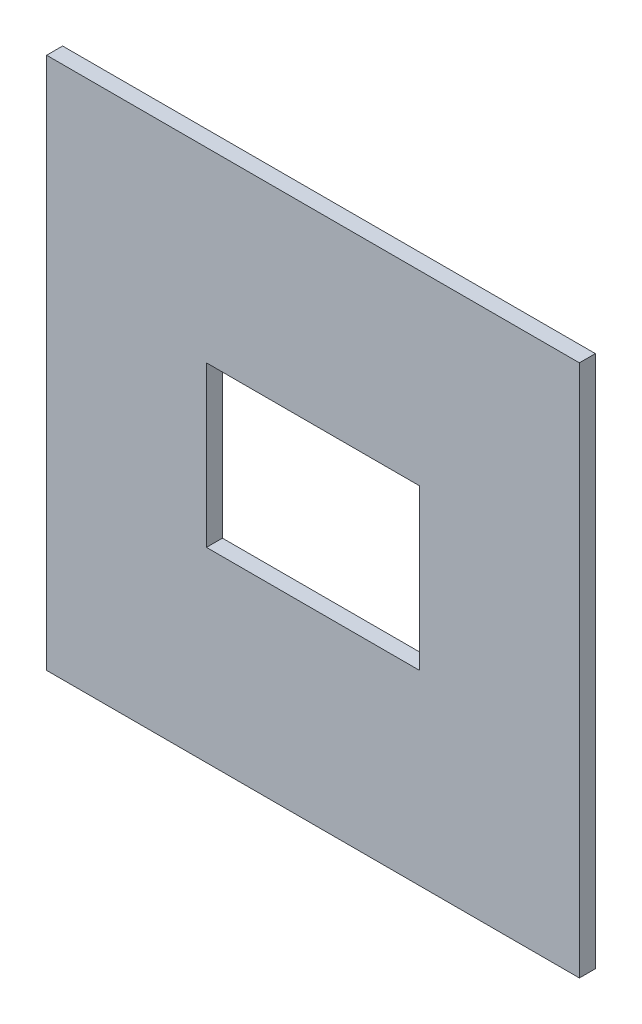
from build123d import *

# Parameters (mm, degrees)
SCHIZZO1_W                   = 500
SCHIZZO1_H                   = 500
ESTRUSIONE_ESTRUSIONE1_DEPTH = 15
SCHIZZO2_W                   = 200
SCHIZZO2_H                   = 150
TAGLIO_ESTRUSIONE1_DEPTH     = 15


with BuildPart() as part:
    # Schizzo1 → Estrusione-Estrusione1 (new body)
    with BuildSketch(Plane.XY):
        Rectangle(SCHIZZO1_W, SCHIZZO1_H)
    extrude(amount=ESTRUSIONE_ESTRUSIONE1_DEPTH)

    # Schizzo2 → Taglio-Estrusione1 (cut)
    with BuildSketch(Plane.XY.offset(15)):
        Rectangle(SCHIZZO2_W, SCHIZZO2_H)
    extrude(amount=-TAGLIO_ESTRUSIONE1_DEPTH, mode=Mode.SUBTRACT)


solid = part.part
